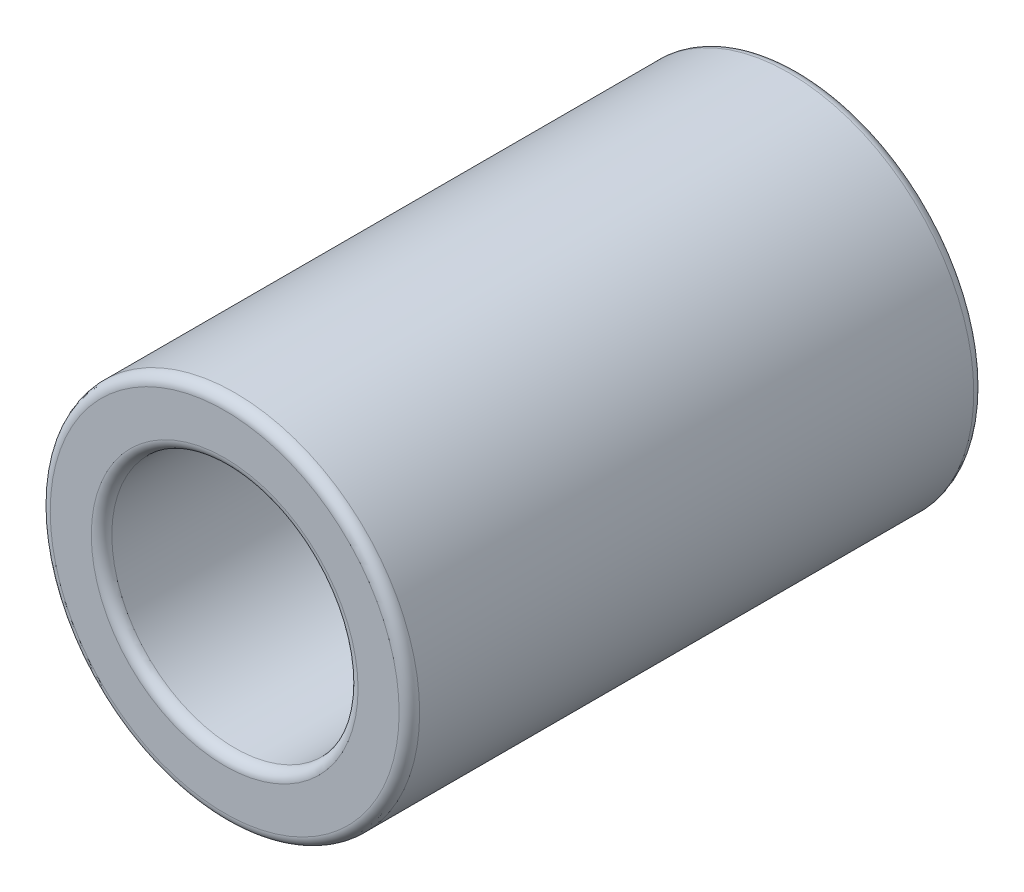
from build123d import *

# Parameters (mm, degrees)
SKETCH_1_R      = 18
SKETCH_1_R_2    = 12
EXTRUDE_1_DEPTH = 28
FILLET_1_R      = 1


with BuildPart() as part:
    # Эскиз1 → Бобышка-Вытянуть1 (new, symmetric)
    with BuildSketch(Plane.XY):
        Circle(SKETCH_1_R)
        Circle(SKETCH_1_R_2, mode=Mode.SUBTRACT)
    extrude(amount=EXTRUDE_1_DEPTH, both=True)

    # Скругление1
    fillet_1_edges = [part.edges().sort_by_distance(p)[0] for p in [
        (-18, 0, -28),
        (-18, 0, 28),
        (-12, 0, -28),
        (-12, 0, 28),
    ]]
    fillet(fillet_1_edges, radius=FILLET_1_R)


solid = part.part
